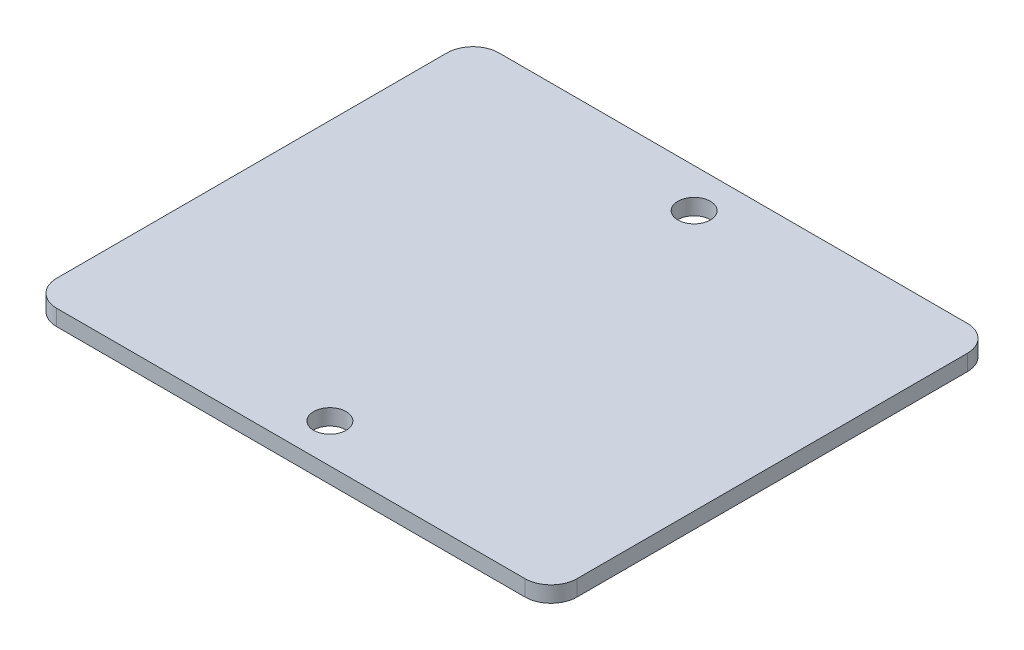
from build123d import *

# Parameters (mm, degrees)
SKETCH1_W           = 50.8
SKETCH1_H           = 43.18
SKETCH1_R           = 1.5875
BOSS_EXTRUDE1_DEPTH = 1.56
FILLET1_R           = 2.54


with BuildPart() as part:
    # Sketch1 → Boss-Extrude1 (new body)
    with BuildSketch(Plane(origin=(0, 0, 0), x_dir=(1, 0, 0), z_dir=(0, 1, 0))):
        Rectangle(SKETCH1_W, SKETCH1_H)
        with Locations(Location((0, 17.78, 0), (0, 0, 90))):
            Circle(SKETCH1_R, mode=Mode.SUBTRACT)
        with Locations(Location((0, -17.78, 0), (0, 0, 90))):
            Circle(SKETCH1_R, mode=Mode.SUBTRACT)
    extrude(amount=BOSS_EXTRUDE1_DEPTH)

    # Fillet1
    fillet1_edges = [part.edges().sort_by_distance(p)[0] for p in [
        (25.4, 0.78, 21.59),
        (-25.4, 0.78, 21.59),
        (-25.4, 0.78, -21.59),
        (25.4, 0.78, -21.59),
    ]]
    fillet(fillet1_edges, radius=FILLET1_R)


solid = part.part
